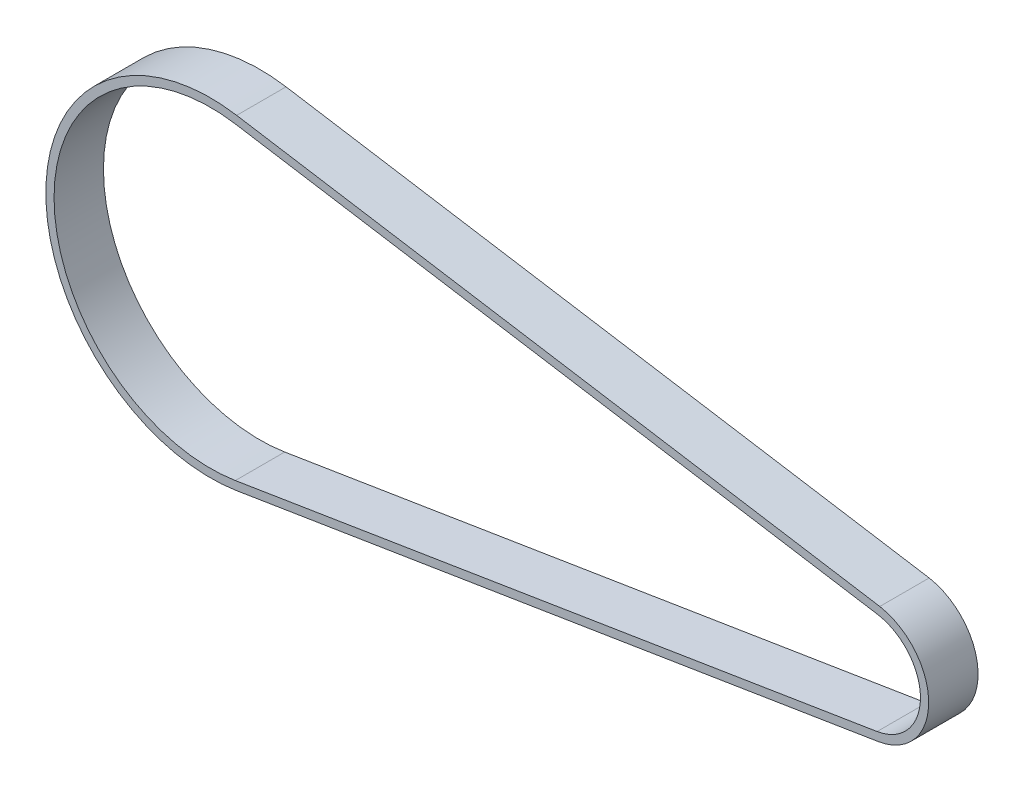
from build123d import *

# Parameters (mm, degrees)
P_IDAT_VYSUNUT_M1_DEPTH = 6


with BuildPart() as part:
    # Skica1 → Přidat vysunutím1 (new body)
    with BuildSketch(Plane.XY):
        with BuildLine():
            Line((3.185, -19.744765762), (81.156155, -7.167349972))
            ThreePointArc((81.156155, -7.167349972), (87.259526133, -0.082947734), (81.319620825, 7.139061625))
            Line((81.319620825, 7.139061625), (3.185472859, 19.74468948))
            ThreePointArc((3.185472859, 19.74468948), (-19.999999999, 0.000239486), (3.185, -19.744765762))
        make_face()
        with BuildLine():
            Line((3.02575, -18.757527474), (80.996905, -6.180111684))
            ThreePointArc((80.996905, -6.180111684), (86.26, 0), (80.996905, 6.180111684))
            Line((80.996905, 6.180111684), (3.02575, 18.757527474))
            ThreePointArc((3.02575, 18.757527474), (-19, 0), (3.02575, -18.757527474))
        make_face(mode=Mode.SUBTRACT)
    extrude(amount=P_IDAT_VYSUNUT_M1_DEPTH)


solid = part.part
